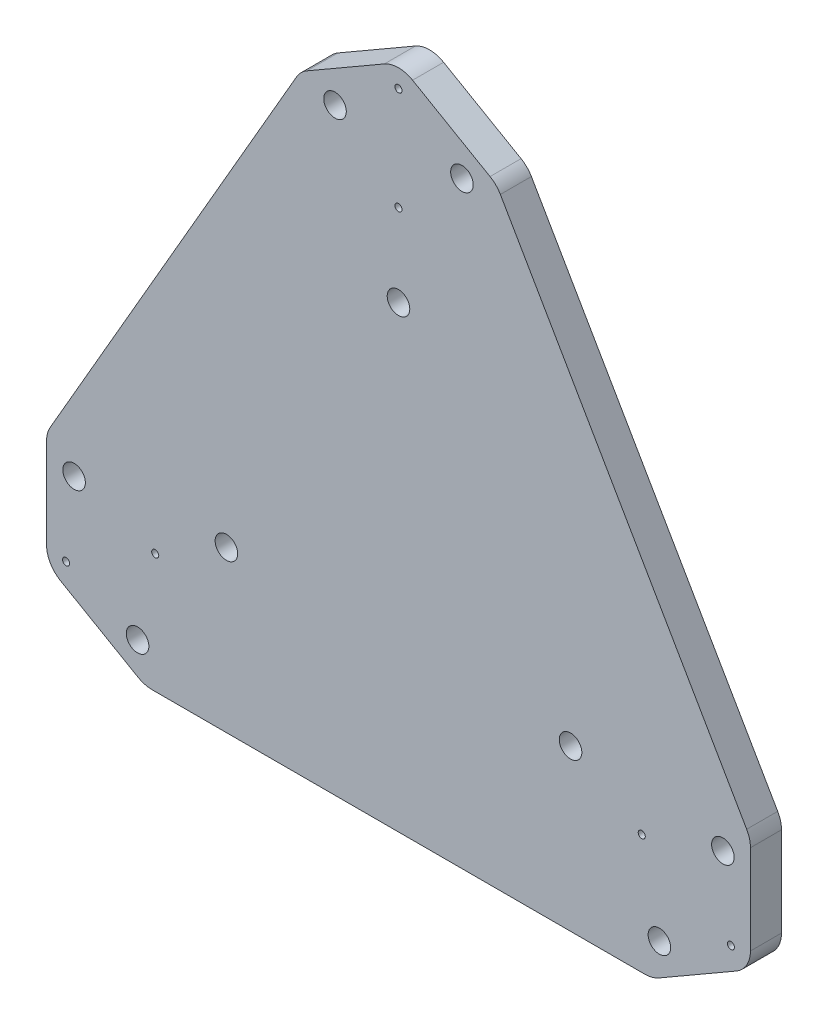
from build123d import *

# Parameters (mm, degrees)
ESQUISSE1_R        = 1.25
ESQUISSE1_R_2      = 4
BOSS_EXTRU_1_DEPTH = 11
CONG_1_R           = 10


with BuildPart() as part:
    # Esquisse1 → Boss.-Extru.1 (new body)
    with BuildSketch(Plane.XY):
        Polygon((34.77820323, 124.002253451), (124.77820323, -31.88231923), (124.77820323, -72.040729224), (90, -92.119934221), (-90, -92.119934221), (-124.77820323, -72.040729224), (-124.77820323, -31.88231923), (-34.77820323, 124.002253451), (0, 144.081458448), align=None)
        with Locations((-117.85, -68.040729224)):
            Circle(ESQUISSE1_R, mode=Mode.SUBTRACT)
        with Locations((117.85, -68.040729224)):
            Circle(ESQUISSE1_R, mode=Mode.SUBTRACT)
        with Locations((0, 136.081458448)):
            Circle(ESQUISSE1_R, mode=Mode.SUBTRACT)
        with Locations((-86.240072762, -49.790729224)):
            Circle(ESQUISSE1_R, mode=Mode.SUBTRACT)
        with Locations((0, 99.581458448)):
            Circle(ESQUISSE1_R, mode=Mode.SUBTRACT)
        with Locations((86.240072762, -49.790729224)):
            Circle(ESQUISSE1_R, mode=Mode.SUBTRACT)
        with Locations((-61, -35.218366421)):
            Circle(ESQUISSE1_R_2, mode=Mode.SUBTRACT)
        with Locations((0, 70.436732841)):
            Circle(ESQUISSE1_R_2, mode=Mode.SUBTRACT)
        with Locations((61, -35.218366421)):
            Circle(ESQUISSE1_R_2, mode=Mode.SUBTRACT)
        with Locations((22.5, 119.800180857)):
            Circle(ESQUISSE1_R_2, mode=Mode.SUBTRACT)
        with Locations((-22.5, 119.800180857)):
            Circle(ESQUISSE1_R_2, mode=Mode.SUBTRACT)
        with Locations((-115, -40.414518843)):
            Circle(ESQUISSE1_R_2, mode=Mode.SUBTRACT)
        with Locations((-92.5, -79.385662014)):
            Circle(ESQUISSE1_R_2, mode=Mode.SUBTRACT)
        with Locations((92.5, -79.385662014)):
            Circle(ESQUISSE1_R_2, mode=Mode.SUBTRACT)
        with Locations((115, -40.414518843)):
            Circle(ESQUISSE1_R_2, mode=Mode.SUBTRACT)
    extrude(amount=BOSS_EXTRU_1_DEPTH)

    # Congé1
    cong_1_edges = [part.edges().sort_by_distance(p)[0] for p in [
        (34.77820323, 124.002253451, 5.5),
        (124.77820323, -31.88231923, 5.5),
        (124.77820323, -72.040729224, 5.5),
        (90, -92.119934221, 5.5),
        (-90, -92.119934221, 5.5),
        (-124.77820323, -72.040729224, 5.5),
        (-124.77820323, -31.88231923, 5.5),
        (-34.77820323, 124.002253451, 5.5),
        (0, 144.081458448, 5.5),
    ]]
    fillet(cong_1_edges, radius=CONG_1_R)


solid = part.part
